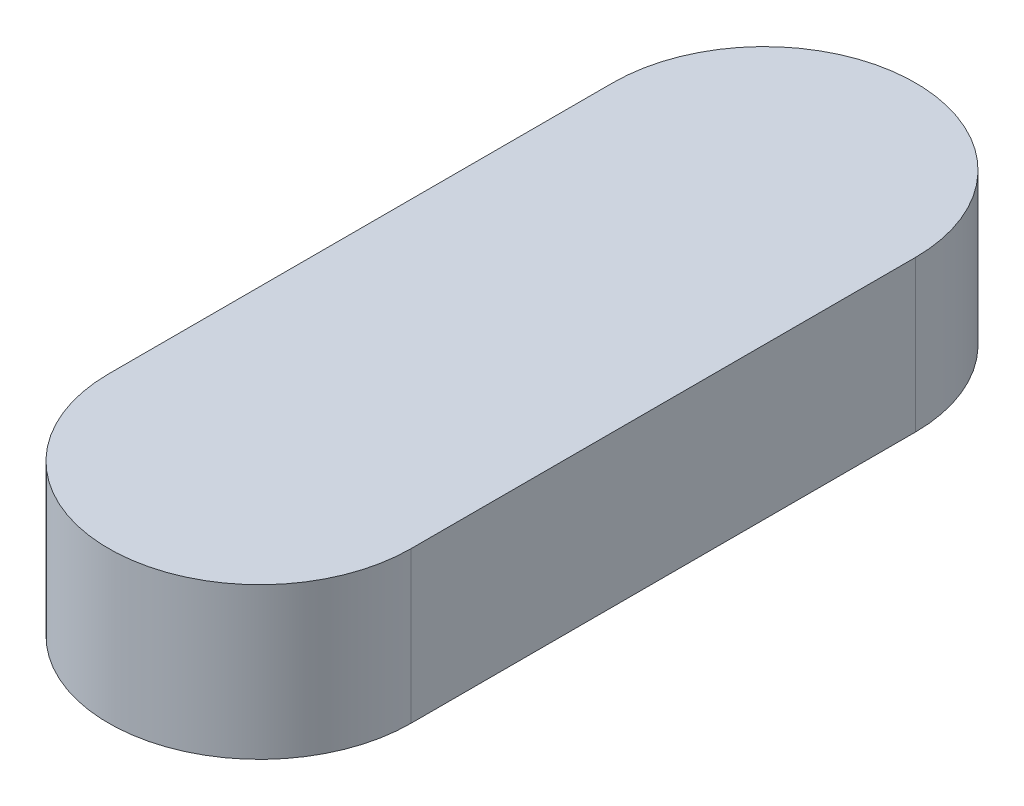
from build123d import *

# Parameters (mm, degrees)
SALIENTE_EXTRUIR1_DEPTH = 3


with BuildPart() as part:
    # Croquis1 → Saliente-Extruir1 (new body)
    with BuildSketch(Plane(origin=(0, 0, 0), x_dir=(1, 0, 0), z_dir=(0, 1, 0))):
        with BuildLine():
            Line((-3, 0), (-3, 10))
            ThreePointArc((-3, 10), (0, 13), (3, 10))
            Line((3, 10), (3, 0))
            ThreePointArc((3, 0), (0, -3), (-3, 0))
        make_face()
    extrude(amount=SALIENTE_EXTRUIR1_DEPTH)


solid = part.part
